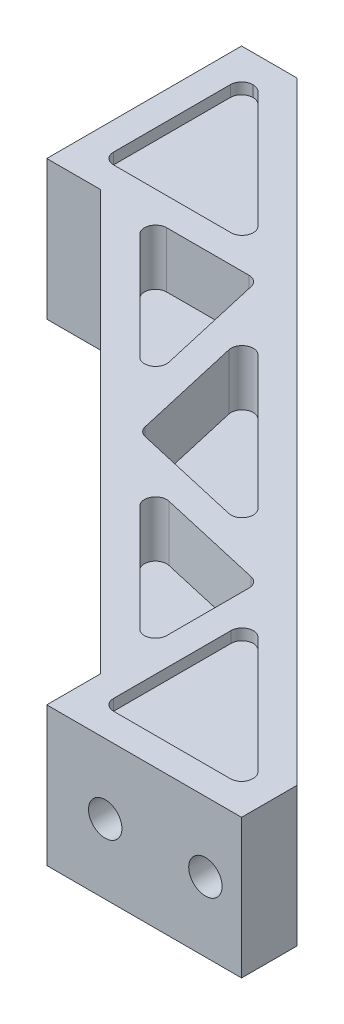
from build123d import *

# Parameters (mm, degrees)
BOSS_EXTRUDE1_DEPTH  = 12.5
CUT_EXTRUDE1_START   = -10
SKETCH2_W            = 31
SKETCH2_H            = 10
CUT_EXTRUDE1_DEPTH   = 161.165360752
CUT_EXTRUDE2_DEPTH   = 10
CUT_EXTRUDE3_DEPTH   = 2
FILLET3_R            = 2
FILLET3_OF_MIRROR2_R = 2
SKETCH6_R            = 3
CUT_EXTRUDE5_DEPTH   = 164.267418673
FILLET4_R            = 3
FILLET4_OF_MIRROR3_R = 3


with BuildPart() as part:
    # Sketch1 → Boss-Extrude1 (new, symmetric)
    with BuildSketch(Plane(origin=(0, 0, 0), x_dir=(1, 0, 0), z_dir=(0, 1, 0))):
        Polygon((0, 120), (10, 120), (120, 10), (120, 0), (85, 0), (85, 9.644660941), (9.644660941, 85), (0, 85), align=None)
    extrude(amount=BOSS_EXTRUDE1_DEPTH, both=True)

    # Sketch2 → Cut-Extrude1 (cut, through all)
    with BuildSketch(Plane.XY.offset(CUT_EXTRUDE1_START)):
        with Locations((104.5, 0)):
            Rectangle(SKETCH2_W, SKETCH2_H)
    cut_extrude1 = extrude(amount=-CUT_EXTRUDE1_DEPTH, mode=Mode.SUBTRACT)

    # Sketch3 → Cut-Extrude2 (cut)
    with BuildSketch(Plane.XZ.offset(12.5)):
        Polygon((57.505379907, -44.210348845), (85, -16.715728753), (85, -37.928932188), align=None)
        Polygon((16.715728753, -85), (37.928932188, -85), (44.210348845, -57.505379907), align=None)
        Polygon((44.576447719, -78.352484469), (78.352484469, -44.576447719), (50.857864376, -50.857864376), align=None)
    cut_extrude2 = extrude(amount=-CUT_EXTRUDE2_DEPTH, mode=Mode.SUBTRACT)

    # Sketch4 → Cut-Extrude3 (cut)
    with BuildSketch(Plane.XZ.offset(12.5)):
        Polygon((5, -90), (32.928932188, -90), (7.928932188, -115), (5, -115), align=None)
        Polygon((115, -5), (90, -5), (90, -32.928932188), (115, -7.928932188), align=None)
    cut_extrude3 = extrude(amount=-CUT_EXTRUDE3_DEPTH, mode=Mode.SUBTRACT)

    # Fillet3
    fillet3_edges = [part.edges().sort_by_distance(p)[0] for p in [
        (16.715728753, -7.5, -85),
        (44.210348845, -7.5, -57.505379907),
        (37.928932188, -7.5, -85),
        (50.857864376, -7.5, -50.857864376),
        (78.352484469, -7.5, -44.576447719),
        (44.576447719, -7.5, -78.352484469),
        (85, -7.5, -37.928932188),
        (57.505379907, -7.5, -44.210348845),
        (85, -7.5, -16.715728753),
        (5, -11.5, -115),
        (5, -11.5, -90),
        (32.928932188, -11.5, -90),
        (7.928932188, -11.5, -115),
        (90, -11.5, -32.928932188),
        (90, -11.5, -5),
        (115, -11.5, -5),
        (115, -11.5, -7.928932188),
    ]]
    fillet(fillet3_edges, radius=FILLET3_R)

    # Mirror2: Cut-Extrude2, Cut-Extrude3 across plane
    add(cut_extrude2.mirror(Plane.ZX), mode=Mode.SUBTRACT)
    add(cut_extrude3.mirror(Plane.ZX), mode=Mode.SUBTRACT)

    # Fillet3 of Mirror2
    fillet3_of_mirror2_edges = [part.edges().sort_by_distance(p)[0] for p in [
        (16.715728753, 7.5, -85),
        (44.210348845, 7.5, -57.505379907),
        (37.928932188, 7.5, -85),
        (50.857864376, 7.5, -50.857864376),
        (78.352484469, 7.5, -44.576447719),
        (44.576447719, 7.5, -78.352484469),
        (85, 7.5, -37.928932188),
        (57.505379907, 7.5, -44.210348845),
        (85, 7.5, -16.715728753),
        (5, 11.5, -115),
        (5, 11.5, -90),
        (32.928932188, 11.5, -90),
        (7.928932188, 11.5, -115),
        (90, 11.5, -32.928932188),
        (90, 11.5, -5),
        (115, 11.5, -5),
        (115, 11.5, -7.928932188),
    ]]
    fillet(fillet3_of_mirror2_edges, radius=FILLET3_OF_MIRROR2_R)

    # Sketch6 → Cut-Extrude5 (cut, through all)
    with BuildSketch(Plane(origin=(0, 0, -10), x_dir=(-1, 0, 0), z_dir=(0, 0, -1))):
        with Locations((-113.5, 0)):
            Circle(SKETCH6_R)
        with Locations((-95.5, 0)):
            Circle(SKETCH6_R)
    cut_extrude5 = extrude(amount=-CUT_EXTRUDE5_DEPTH, mode=Mode.SUBTRACT)

    # Fillet4
    fillet4_edges = [part.edges().sort_by_distance(p)[0] for p in [
        (89, -5, -25.5),
        (89, 5, -25.5),
    ]]
    fillet(fillet4_edges, radius=FILLET4_R)

    # Mirror3: Cut-Extrude1, Cut-Extrude5 across plane
    add(cut_extrude1.mirror(Plane(origin=(0, 0, 0), x_dir=(-0.7071067811865475, 0, 0.7071067811865477), z_dir=(0.7071067811865476, 0, 0.7071067811865475))), mode=Mode.SUBTRACT)
    add(cut_extrude5.mirror(Plane(origin=(0, 0, 0), x_dir=(-0.7071067811865475, 0, 0.7071067811865477), z_dir=(0.7071067811865476, 0, 0.7071067811865475))), mode=Mode.SUBTRACT)

    # Fillet4 of Mirror3
    fillet4_of_mirror3_edges = [part.edges().sort_by_distance(p)[0] for p in [
        (25.5, -5, -89),
        (25.5, 5, -89),
    ]]
    fillet(fillet4_of_mirror3_edges, radius=FILLET4_OF_MIRROR3_R)


solid = part.part
